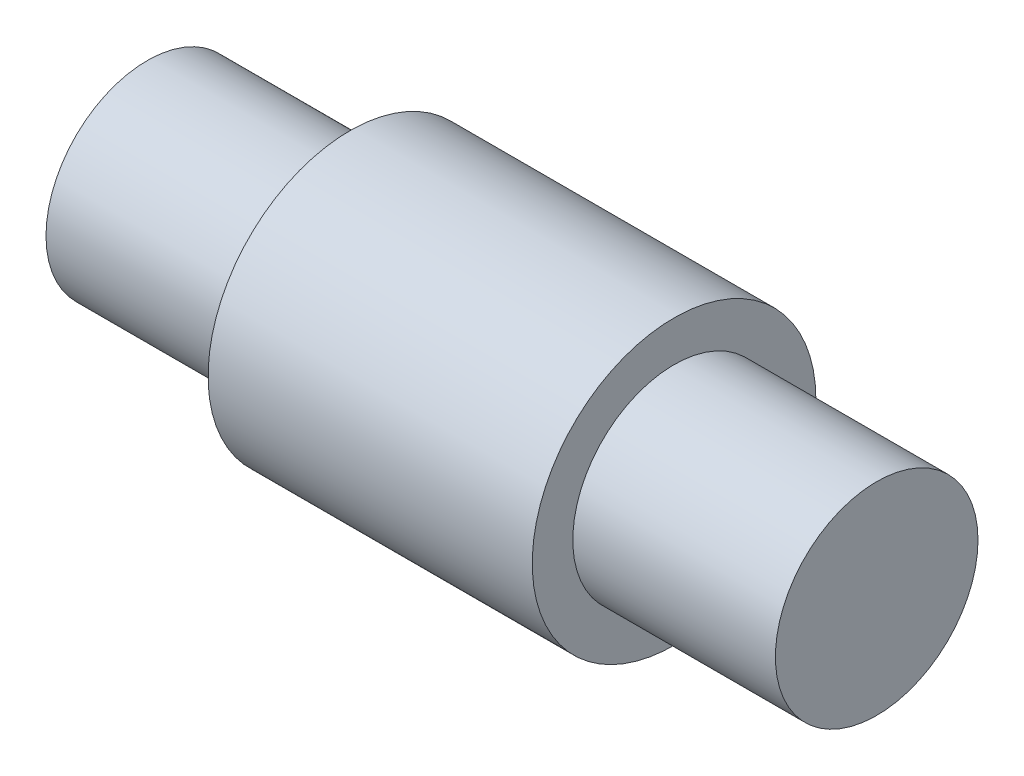
from build123d import *

# Parameters (mm, degrees)
SKETCH1_R           = 7
BOSS_EXTRUDE1_DEPTH = 16
SKETCH2_R           = 5
BOSS_EXTRUDE2_DEPTH = 10
BOSS_EXTRUDE3_START = 10
SKETCH3_R           = 5
BOSS_EXTRUDE3_DEPTH = 10


with BuildPart() as part:
    # Sketch1 → Boss-Extrude1 (new body)
    with BuildSketch(Plane(origin=(0, 0, 0), x_dir=(0, 0, -1), z_dir=(1, 0, 0))):
        Circle(SKETCH1_R)
    extrude(amount=BOSS_EXTRUDE1_DEPTH)

    # Sketch2 → Boss-Extrude2 (add)
    with BuildSketch(Plane(origin=(16, 0, 0), x_dir=(0, 0, -1), z_dir=(1, 0, 0))):
        Circle(SKETCH2_R)
    extrude(amount=BOSS_EXTRUDE2_DEPTH)

    # Sketch3 → Boss-Extrude3 (add)
    with BuildSketch(Plane.ZY.offset(BOSS_EXTRUDE3_START)):
        with Locations(Location((0, 0, 0), (0, 0, 180))):
            Circle(SKETCH3_R)
    extrude(amount=-BOSS_EXTRUDE3_DEPTH)


solid = part.part
